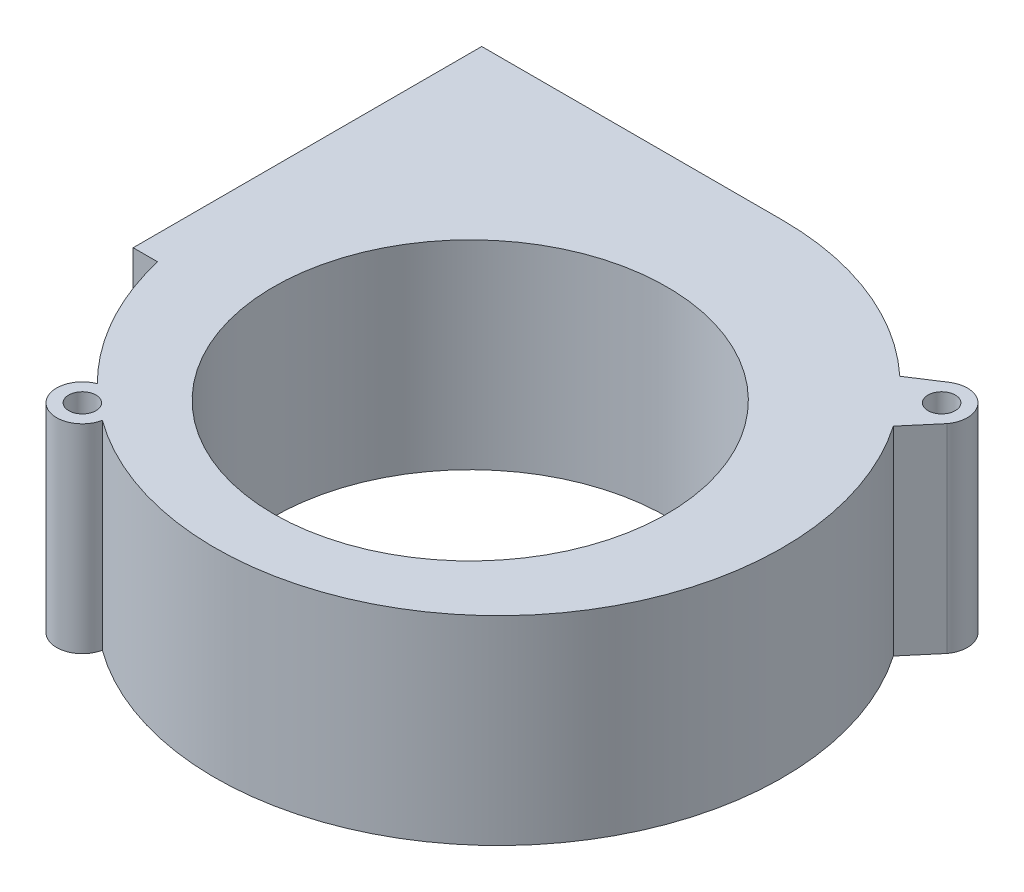
from build123d import *

# Parameters (mm, degrees)
SKETCH_1_R      = 2.25
SKETCH_1_R_2    = 32.5
EXTRUDE_1_DEPTH = 32.9


with BuildPart() as part:
    # 草图1 → 凸台-拉伸1 (new body)
    with BuildSketch(Plane(origin=(0, 0, 0), x_dir=(1, 0, 0), z_dir=(0, 1, 0))):
        with BuildLine():
            Line((32.038228151, 34.251451604), (36.985161154, 37.464270068))
            ThreePointArc((36.985161154, 37.464270068), (42.395709987, 36.811885931), (42.716072869, 31.371572396))
            Line((42.716072869, 31.371572396), (38.645559751, 26.573120094))
            ThreePointArc((38.645559751, 26.573120094), (32.742735514, -33.578613299), (-27.538659341, -37.96356466))
            ThreePointArc((-27.538659341, -37.96356466), (-34.46083935, -40.331140059), (-33.202224105, -33.12434625))
            ThreePointArc((-33.202224105, -33.12434625), (-40.995709816, -22.780732575), (-45.663114217, -10.7))
            Line((-45.663114217, -10.7), (-49.7, -10.7))
            Line((-49.7, -10.7), (-49.7, 46.9))
            Line((-49.7, 46.9), (0, 46.9))
            ThreePointArc((0, 46.9), (17.222324463, 43.623405875), (32.038228151, 34.251451604))
        make_face()
        with Locations(Location((-31.7, -37.1, 0), (0, 0, 270))):
            Circle(SKETCH_1_R, mode=Mode.SUBTRACT)
        with Locations(Location((39.3, 33.9, 0), (0, 0, 270))):
            Circle(SKETCH_1_R, mode=Mode.SUBTRACT)
        with Locations(Location((0, -4.7, 0), (0, 0, 270))):
            Circle(SKETCH_1_R_2, mode=Mode.SUBTRACT)
    extrude(amount=EXTRUDE_1_DEPTH)


solid = part.part
